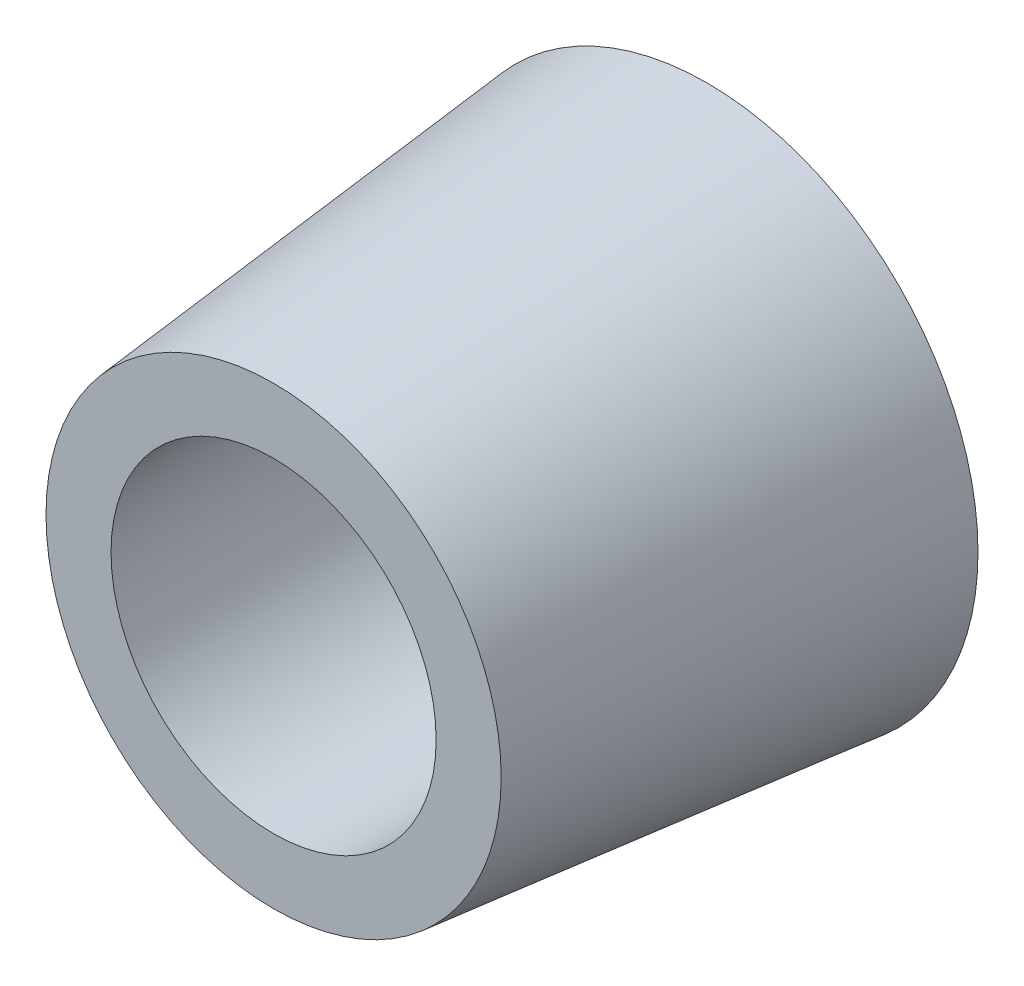
from build123d import *

# Parameters (mm, degrees)
SZKIC1_R                   = 2.5
SZKIC2_R                   = 2.1
SZKIC3_R                   = 1.5
WYTNIJ_WYCI_GNI_CIE1_DEPTH = 10


with BuildPart() as part:
    # Szkic1 → Wyciągnięcie po profilach1 section 0
    with BuildSketch(Plane.XY):
        Circle(SZKIC1_R)
    # Szkic2 → Wyciągnięcie po profilach1 section 1
    with BuildSketch(Plane.XY.offset(4)):
        Circle(SZKIC2_R)
    loft()

    # Szkic3 → Wytnij-wyciągnięcie1 (cut)
    with BuildSketch(Plane.XY.offset(4)):
        Circle(SZKIC3_R)
    extrude(amount=-WYTNIJ_WYCI_GNI_CIE1_DEPTH, mode=Mode.SUBTRACT)


solid = part.part
